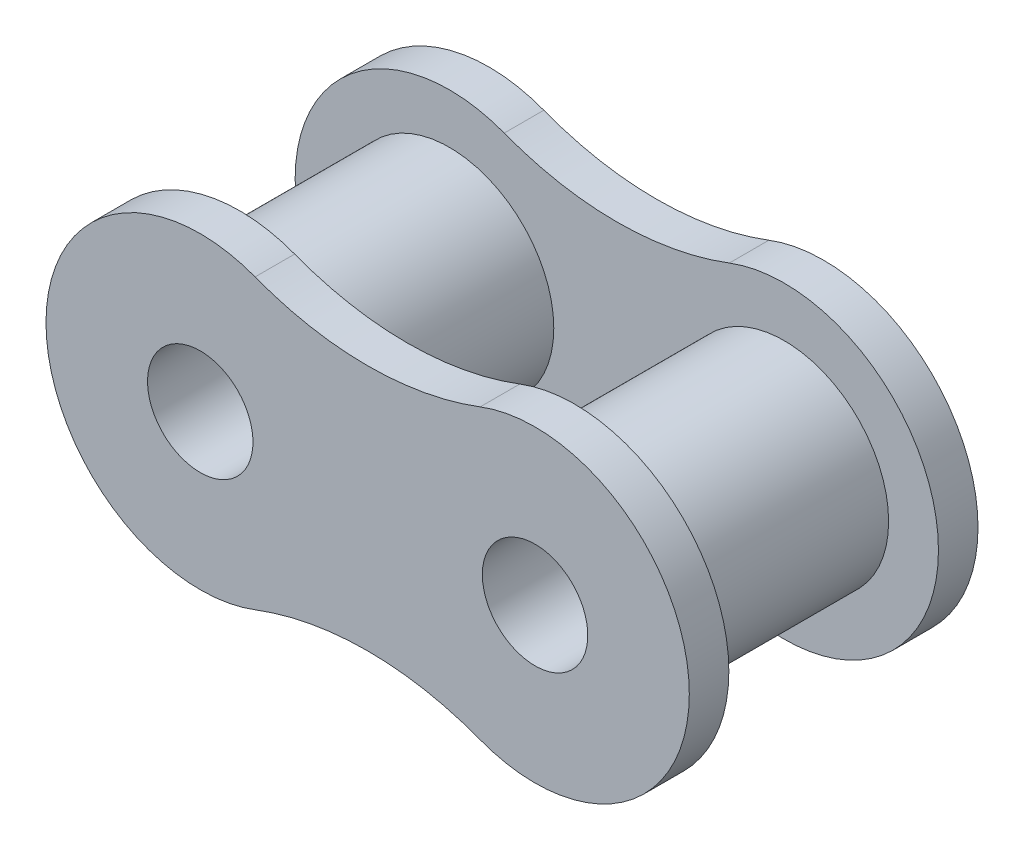
from build123d import *

# Parameters (mm, degrees)
BOSS_EXTRUDE1_DEPTH = 1.5
SKETCH2_R           = 3.96
BOSS_EXTRUDE2_DEPTH = 7.95
SKETCH3_R           = 2
CUT_EXTRUDE1_DEPTH  = 23.321010282


with BuildPart() as part:
    # Sketch1 → Boss-Extrude1 (new body)
    with BuildSketch(Plane.XY):
        with BuildLine():
            ThreePointArc((2.081092437, 5.467316917), (-5.85, 0), (2.081092437, -5.467316917))
            ThreePointArc((2.081092437, -5.467316917), (6.35, -4.682325977), (10.618907563, -5.467316917))
            ThreePointArc((10.618907563, -5.467316917), (18.55, 0), (10.618907563, 5.467316917))
            ThreePointArc((10.618907563, 5.467316917), (6.35, 4.682325977), (2.081092437, 5.467316917))
        make_face()
    extrude(amount=BOSS_EXTRUDE1_DEPTH)


with BuildPart() as body_2:
    # Mirror2: mirrored copy
    add(part.part.mirror(Plane.XY.offset(5.475)))


with BuildPart() as part_1:
    add(part.part)

    add(body_2.part)  # Boss-Extrude2 merges body 2
    # Sketch2 → Boss-Extrude2 (add)
    with BuildSketch(Plane.XY.offset(1.5)):
        with Locations(Location((0, 0, 0), (0, 0, 180))):
            Circle(SKETCH2_R)
        with Locations(Location((12.7, 0, 0), (0, 0, 180))):
            Circle(SKETCH2_R)
    extrude(amount=BOSS_EXTRUDE2_DEPTH)

    # Sketch3 → Cut-Extrude1 (cut, through all)
    with BuildSketch(Plane(origin=(0, 0, 0), x_dir=(-1, 0, 0), z_dir=(0, 0, -1))):
        Circle(SKETCH3_R)
        with Locations((-12.7, 0)):
            Circle(SKETCH3_R)
    extrude(amount=-CUT_EXTRUDE1_DEPTH, mode=Mode.SUBTRACT)


solid = part_1.part
